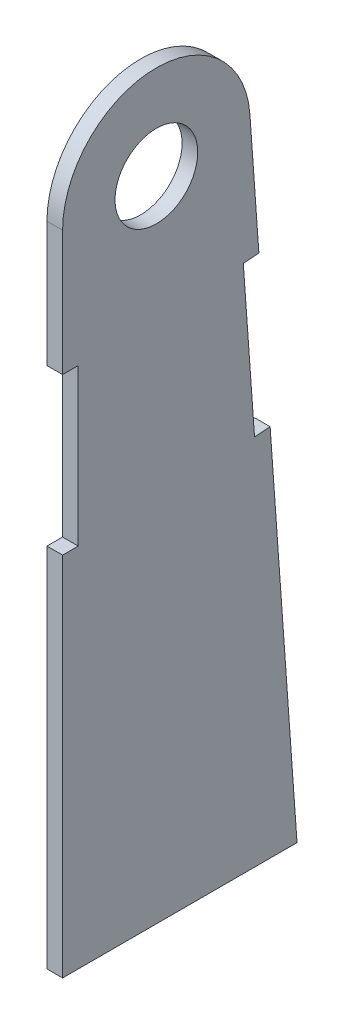
from build123d import *

# Parameters (mm, degrees)
BOSS_EXTRUDE1_DEPTH  = 1.5875
M8_CLEARANCE_HOLE1_D = 8.4


with BuildPart() as part:
    # Sketch1 → Boss-Extrude1 (new body)
    with BuildSketch(Plane(origin=(0, 0, 0), x_dir=(0, 0, -1), z_dir=(1, 0, 0))):
        with BuildLine():
            Line((-9.525, -65.774638339), (0, -65.774638339))
            Line((0, -65.774638339), (14.2875, -65.774638339))
            Line((14.2875, -65.774638339), (11.553356238, -27.816833207))
            Line((11.553356238, -27.816833207), (9.96995864, -27.930887132))
            Line((9.96995864, -27.930887132), (8.829419389, -12.096911155))
            Line((8.829419389, -12.096911155), (10.412816987, -11.98285723))
            Line((10.412816987, -11.98285723), (9.500385586, 0.684323551))
            ThreePointArc((9.500385586, 0.684323551), (-0.342383043, 9.518844407), (-9.525, 0))
            Line((-9.525, 0), (-9.525, -12.7))
            Line((-9.525, -12.7), (-7.9375, -12.7))
            Line((-7.9375, -12.7), (-7.9375, -28.575))
            Line((-7.9375, -28.575), (-9.525, -28.575))
            Line((-9.525, -28.575), (-9.525, -65.774638339))
        make_face()
    extrude(amount=BOSS_EXTRUDE1_DEPTH)

    # M8 Clearance Hole1 (through all)
    with Locations(Plane(origin=(1.5875, 0, 0), x_dir=(0, 0, -1), z_dir=(1, 0, 0))):
        with Locations((0, 0)):
            Hole(M8_CLEARANCE_HOLE1_D / 2)


solid = part.part
